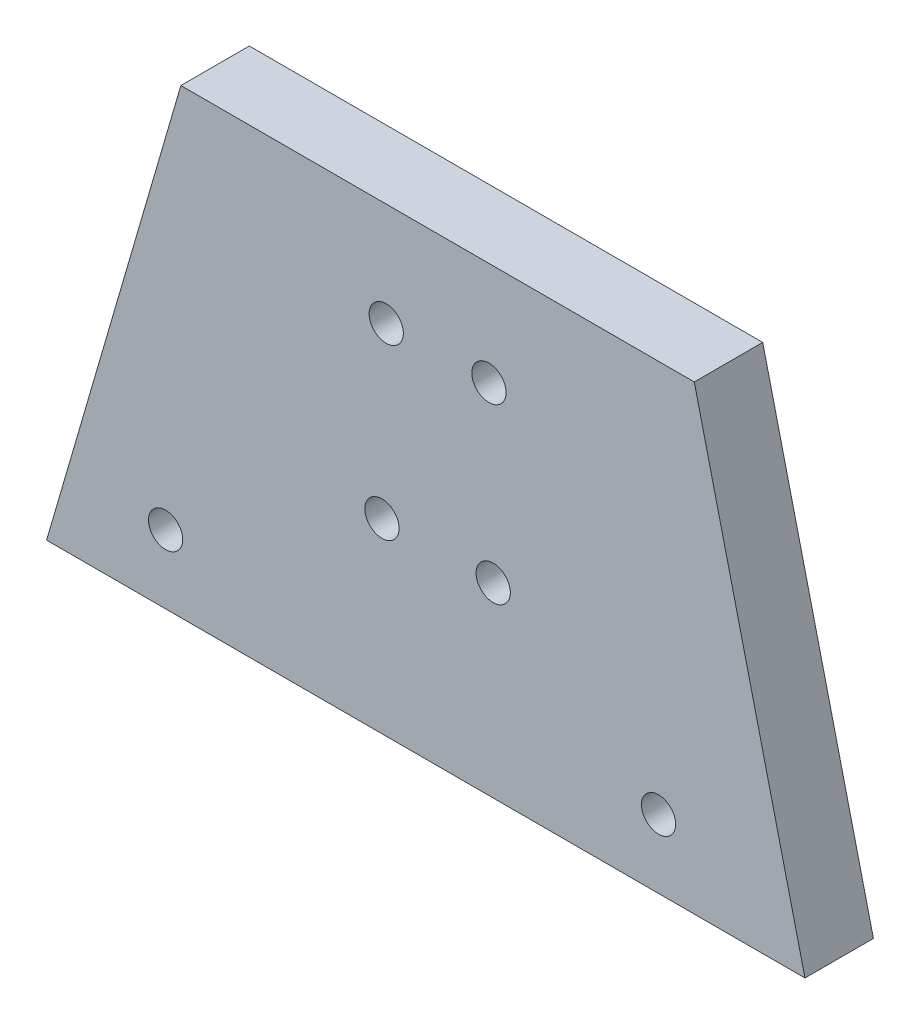
from build123d import *

# Parameters (mm, degrees)
EXTRUDE_1_DEPTH     = 20
SKETCH_2_R          = 5
CUT_EXTRUDE_1_DEPTH = 232.102536476
SKETCH_3_W          = 32.604324085
SKETCH_3_H          = 2.91589364
SKETCH_3_W_2        = 9.316519648
SKETCH_3_H_2        = 2.560664992
SKETCH_3_W_3        = 11.683825265
EXTRUDE_2_DEPTH     = 48
SKETCH_5_R          = 5
CUT_EXTRUDE_2_DEPTH = 28


with BuildPart() as part:
    # 草图1 → 凸台-拉伸1 (new body)
    with BuildSketch(Plane.XY):
        Polygon((17.319300214, 114.65132411), (167.319300214, 114.65132411), (199.6583488, -20.002569933), (-21.915099237, -20.002569933), align=None)
    extrude(amount=EXTRUDE_1_DEPTH)

    # 草图2 → 切除-拉伸1 (cut, through all)
    with BuildSketch(Plane.XY.offset(20)):
        with Locations((77.319300214, 84.433001075)):
            Circle(SKETCH_2_R)
        with Locations((76.069300214, 34.448628517)):
            Circle(SKETCH_2_R)
        with Locations(Location((108.569300214, 34.448628517, 0), (0, 0, 180))):
            Circle(SKETCH_2_R)
        with Locations(Location((107.319300214, 84.433001075, 0), (0, 0, 180))):
            Circle(SKETCH_2_R)
    extrude(amount=-CUT_EXTRUDE_1_DEPTH, mode=Mode.SUBTRACT)

    # 草图3 → 凸台-拉伸2 (add)
    with BuildSketch(Plane.XY.offset(20)):
        with Locations((76.385027523, -13.259318303)):
            Rectangle(SKETCH_3_W, SKETCH_3_H)
        with Locations((67.171853972, 82.139796752)):
            Rectangle(SKETCH_3_W_2, SKETCH_3_H_2)
        with Locations((88.67813561, 82.139796752)):
            Rectangle(SKETCH_3_W_3, SKETCH_3_H_2)
    extrude(amount=-EXTRUDE_2_DEPTH)

    # 草图5 → 切除-拉伸2 (cut)
    with BuildSketch(Plane(origin=(0, 0, 0), x_dir=(-1, 0, 0), z_dir=(0, 0, -1))):
        with Locations((-156.886362857, -0.002569933)):
            Circle(SKETCH_5_R)
        with Locations((-12.853580473, -0.002569933)):
            Circle(SKETCH_5_R)
    extrude(amount=-CUT_EXTRUDE_2_DEPTH, mode=Mode.SUBTRACT)


solid = part.part
